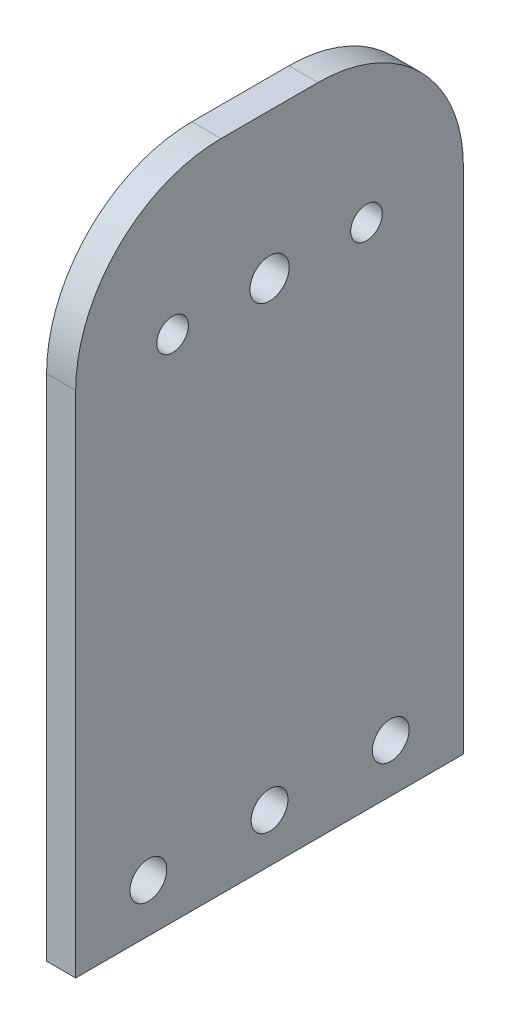
from build123d import *

# Parameters (mm, degrees)
BOSS_EXTRUDE1_DEPTH   = 3
F_6_CLEARANCE_HOLE2_D = 3.7973
SKETCH10_R            = 2.025
CUT_EXTRUDE1_DEPTH    = 10
F_4_CLEARANCE_HOLE3_D = 3.2639


with BuildPart() as part:
    # Sketch1 → Boss-Extrude1 (new body)
    with BuildSketch(Plane(origin=(0, 0, 0), x_dir=(0, 0, -1), z_dir=(1, 0, 0))):
        with BuildLine():
            Line((0, 52.5), (0, 0))
            Line((0, 0), (40, 0))
            Line((40, 0), (40, 52.5))
            ThreePointArc((40, 52.5), (35.606601718, 63.106601718), (25, 67.5))
            Line((25, 67.5), (15, 67.5))
            ThreePointArc((15, 67.5), (4.393398282, 63.106601718), (0, 52.5))
        make_face()
    extrude(amount=BOSS_EXTRUDE1_DEPTH)

    # #6 Clearance Hole2 (through all)
    with Locations(Plane(origin=(3, 0, 0), x_dir=(0, 0, -1), z_dir=(1, 0, 0))):
        with Locations((7.5, 5), (20, 5), (32.5, 5)):
            Hole(F_6_CLEARANCE_HOLE2_D / 2)

    # Sketch10 → Cut-Extrude1 (cut)
    with BuildSketch(Plane(origin=(3, 0, 0), x_dir=(0, 0, -1), z_dir=(1, 0, 0))):
        with Locations((20, 52.5)):
            Circle(SKETCH10_R)
    extrude(amount=-CUT_EXTRUDE1_DEPTH, mode=Mode.SUBTRACT)

    # #4 Clearance Hole3 (through all)
    with Locations(Plane(origin=(3, 0, 0), x_dir=(0, 0, -1), z_dir=(1, 0, 0))):
        with Locations((10, 52.5), (30, 52.5)):
            Hole(F_4_CLEARANCE_HOLE3_D / 2)


solid = part.part
